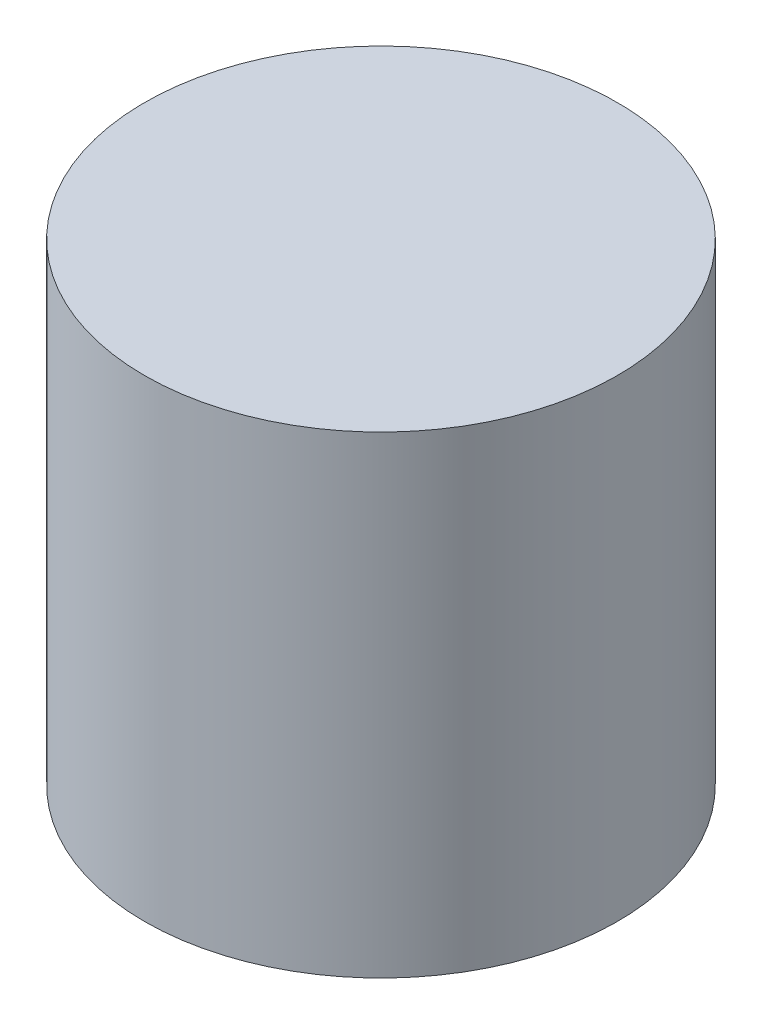
from build123d import *

# Parameters (mm, degrees)
SKETCH_1_R      = 17.5
EXTRUDE_1_DEPTH = 35


with BuildPart() as part:
    # Эскиз1 → Бобышка-Вытянуть1 (new body)
    with BuildSketch(Plane(origin=(0, 0, 0), x_dir=(1, 0, 0), z_dir=(0, 1, 0))):
        with Locations(Location((0, 0, 0), (0, 0, 270))):
            Circle(SKETCH_1_R)
    extrude(amount=EXTRUDE_1_DEPTH)


solid = part.part
